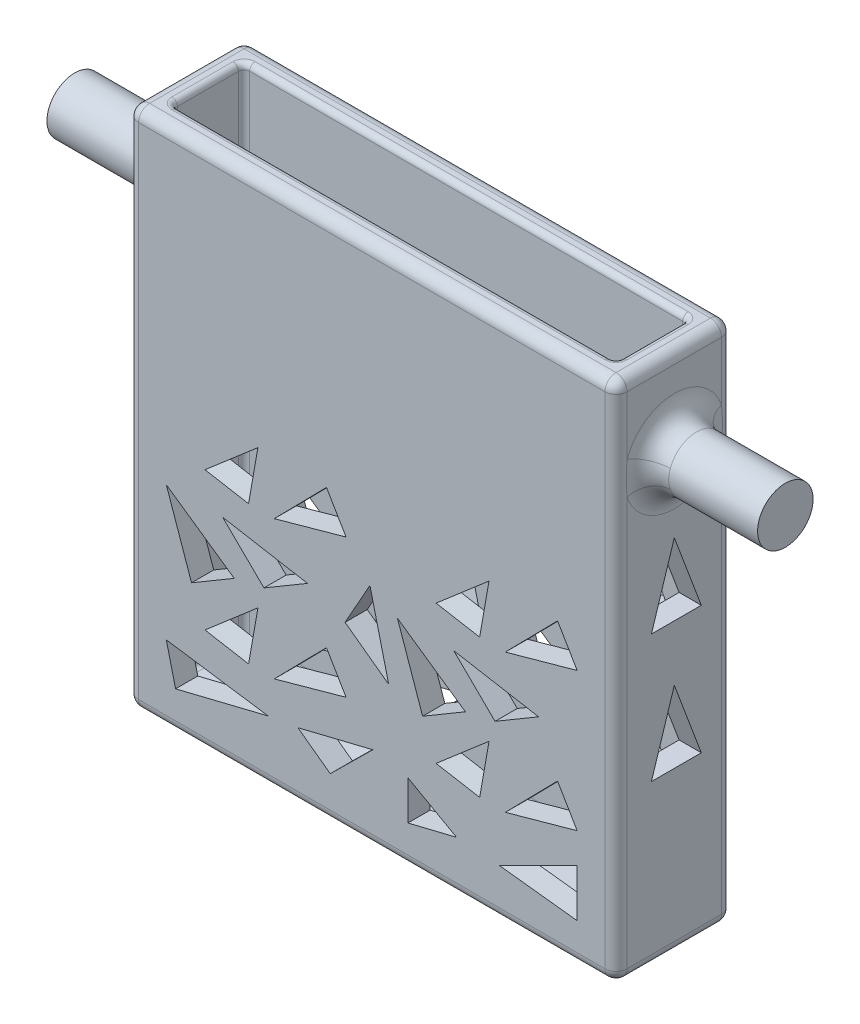
from build123d import *

# Parameters (mm, degrees)
SKETCH1_W               = 88
SKETCH1_H               = 21
SKETCH1_W_2             = 80
SKETCH1_H_2             = 13
BOSS_EXTRUDE1_DEPTH     = 90
SKETCH2_W               = 88
SKETCH2_H               = 21
BOSS_EXTRUDE2_DEPTH     = 4
FILLET1_R               = 1
FILLET2_R               = 2
CUT_EXTRUDE1_DEPTH      = 103.357217625
CUT_EXTRUDE1_DEPTH_BACK = 103.357217625
CUT_EXTRUDE2_DEPTH      = 127.310134194
CUT_EXTRUDE2_DEPTH_BACK = 127.310134194
SKETCH5_R               = 5
BOSS_EXTRUDE3_DEPTH     = 20
FILLET3_R               = 4
SKETCH6_R               = 3
BOSS_EXTRUDE4_DEPTH     = 6
FILLET4_R               = 2


with BuildPart() as part:
    # Sketch1 → Boss-Extrude1 (new body)
    with BuildSketch(Plane(origin=(0, 0, 0), x_dir=(1, 0, 0), z_dir=(0, 1, 0))):
        Rectangle(SKETCH1_W, SKETCH1_H)
        Rectangle(SKETCH1_W_2, SKETCH1_H_2, mode=Mode.SUBTRACT)
    extrude(amount=BOSS_EXTRUDE1_DEPTH)

    # Sketch2 → Boss-Extrude2 (add)
    with BuildSketch(Plane.XZ):
        Rectangle(SKETCH2_W, SKETCH2_H)
    extrude(amount=BOSS_EXTRUDE2_DEPTH)

    # Fillet1
    fillet1_edges = [part.edges().sort_by_distance(p)[0] for p in [
        (0, 0, -6.5),
        (40, 45, -6.5),
        (-40, 0, 0),
        (-40, 45, -6.5),
        (0, 0, 6.5),
        (-40, 45, 6.5),
        (40, 0, 0),
        (40, 45, 6.5),
        (0, 90, -6.5),
        (-40, 90, 0),
        (0, 90, 6.5),
        (40, 90, 0),
    ]]
    fillet(fillet1_edges, radius=FILLET1_R)

    # Fillet2
    fillet2_edges = [part.edges().sort_by_distance(p)[0] for p in [
        (44, 90, 0),
        (0, 90, -10.5),
        (0, -4, 10.5),
        (-44, -4, 0),
        (0, -4, -10.5),
        (44, -4, 0),
        (-44, 90, 0),
        (-44, 43, -10.5),
        (44, 43, -10.5),
        (44, 43, 10.5),
        (-44, 43, 10.5),
        (0, 90, 10.5),
    ]]
    fillet(fillet2_edges, radius=FILLET2_R)

    # Sketch3 → Cut-Extrude1 (cut, two sides: drawn at the far end of the back side and taken through both)
    with BuildSketch(Plane.XY.offset(10.5).offset(-CUT_EXTRUDE1_DEPTH_BACK)):
        Polygon((24.061566872, 38.431975856), (33.473075298, 48.012562007), (37, 42.032124468), align=None)
        Polygon((21.123781138, 48.04589072), (19.441971467, 38.451719211), (11.590979563, 39.827958327), align=None)
        Polygon((4.625005171, 34.008542475), (9.16573338, 20.978626746), (16.865229038, 25.519354954), align=None)
        Polygon((30.052970909, 31.330476023), (14.775481851, 34.008542475), (22.210059882, 26.70516952), align=None)
        Polygon((24.061566872, 13.436247093), (33.473075298, 23.016833244), (37, 17.036395705), align=None)
        Polygon((21.123781138, 23.050161957), (19.441971467, 13.455990449), (11.590979563, 14.832229564), align=None)
        Polygon((-17.5634383, 38.431975856), (-8.151929874, 48.012562007), (-4.625005171, 42.032124468), align=None)
        Polygon((-20.501224033, 48.04589072), (-22.183033704, 38.451719211), (-30.034025609, 39.827958327), align=None)
        Polygon((-37, 34.008542475), (-32.459271791, 20.978626746), (-24.759776133, 25.519354954), align=None)
        Polygon((-11.572034262, 31.330476023), (-26.84952332, 34.008542475), (-19.414945289, 26.70516952), align=None)
        Polygon((-17.5634383, 13.436247093), (-8.151929874, 23.016833244), (-4.625005171, 17.036395705), align=None)
        Polygon((-20.501224033, 23.050161957), (-22.183033704, 13.455990449), (-30.034025609, 14.832229564), align=None)
        Polygon((-0.325446393, 36.623348647), (-4.804973245, 28.638464211), (3.057177091, 22.887683727), align=None)
        Polygon((-37, 9.811792884), (-18.670668462, 7.103248072), (-35.332540783, 3), align=None)
        Polygon((0.188458488, 11.260610818), (-13.301314854, 7.958448335), (-7.470753122, 3.69367608), align=None)
        Polygon((6.51655393, 10.055707958), (15.272805641, 5.143443419), (6.51655393, 3), align=None)
        Polygon((37, 11.587968803), (23.028744317, 4.600726362), (37, 3), align=None)
    extrude(amount=CUT_EXTRUDE1_DEPTH + CUT_EXTRUDE1_DEPTH_BACK, mode=Mode.SUBTRACT)

    # Sketch4 → Cut-Extrude2 (cut, two sides: drawn at the far end of the back side and taken through both)
    with BuildSketch(Plane.ZY.offset(44).offset(-CUT_EXTRUDE2_DEPTH_BACK)):
        Polygon((0, 60.988646295), (-4.862206559, 48.022707409), (4.125546533, 48.022707409), align=None)
        Polygon((0, 37.977292591), (-4.862206559, 25.011353705), (4.125546533, 25.011353705), align=None)
    extrude(amount=CUT_EXTRUDE2_DEPTH + CUT_EXTRUDE2_DEPTH_BACK, mode=Mode.SUBTRACT)

    # Sketch5 → Boss-Extrude3 (add)
    with BuildSketch(Plane.ZY.offset(44)):
        with Locations(Location((0, 74.494323148, 0), (0, 0, 180))):
            Circle(SKETCH5_R)
    boss_extrude3 = extrude(amount=BOSS_EXTRUDE3_DEPTH)

    # Mirror1: Boss-Extrude3 across plane
    add(boss_extrude3.mirror(Plane(origin=(0, 0, 0), x_dir=(0, 0, 1), z_dir=(1, 0, 0))))

    # Fillet3
    fillet3_edges = [part.edges().sort_by_distance(p)[0] for p in [
        (-44, 74.494323148, 5),
        (44, 74.494323148, 5),
    ]]
    fillet(fillet3_edges, radius=FILLET3_R)

    # Sketch6 → Boss-Extrude4 (add)
    with BuildSketch(Plane.ZY.offset(44)):
        with Locations(Location((0, 6, 0), (0, 0, 180))):
            Circle(SKETCH6_R)
    extrude(amount=BOSS_EXTRUDE4_DEPTH)

    # Fillet4
    fillet4_edges = [part.edges().sort_by_distance(p)[0] for p in [
        (-44, 6, 3),
    ]]
    fillet(fillet4_edges, radius=FILLET4_R)


solid = part.part
